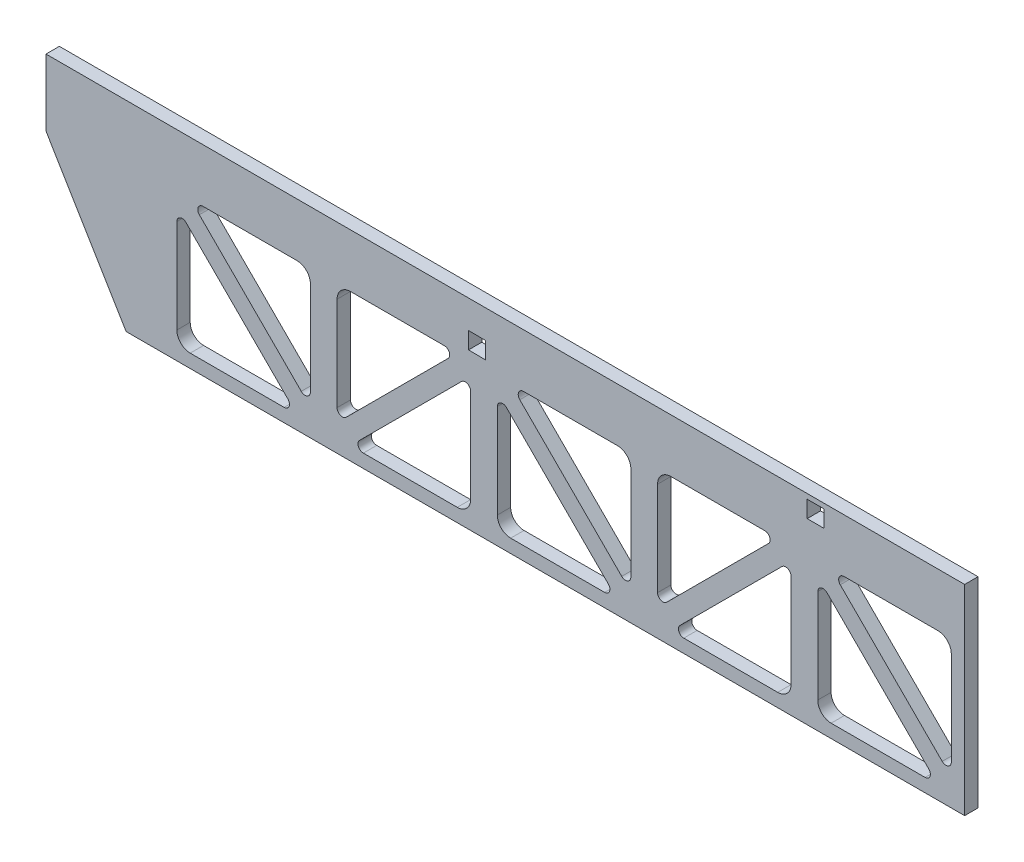
from build123d import *

# Parameters (mm, degrees)
MODEL_W             = 8.001
MODEL_H             = 8.001
BOSS_EXTRUDE1_DEPTH = 6.35


with BuildPart() as part:
    # Model → Boss-Extrude1 (new body)
    with BuildSketch(Plane.XY):
        Polygon((-398.78, 0), (-436.88, 63.5), (-436.88, 95.25), (0, 95.25), (0, 0), align=None)
        with Locations((-70.891200524, 88.9)):
            Rectangle(MODEL_W, MODEL_H, mode=Mode.SUBTRACT)
        Polygon((-235.938184475, 73.86541105), (-227.937630461, 73.78093355), (-227.853152962, 81.781487564), (-235.853706976, 81.865965064), align=None, mode=Mode.SUBTRACT)
        with BuildLine():
            Line((-171.232102448, 6.35), (-215.9, 6.35))
            ThreePointArc((-215.9, 6.35), (-220.390128061, 8.209871939), (-222.25, 12.7))
            Line((-222.25, 12.7), (-222.25, 57.367897552))
            ThreePointArc((-222.25, 57.367897552), (-220.682015918, 59.714551564), (-217.913948776, 59.163948776))
            Line((-217.913948776, 59.163948776), (-169.436051224, 10.686051224))
            ThreePointArc((-169.436051224, 10.686051224), (-168.885448436, 7.917984082), (-171.232102448, 6.35))
        make_face(mode=Mode.SUBTRACT)
        with BuildLine():
            Line((-234.95, 57.367897552), (-234.95, 12.7))
            ThreePointArc((-234.95, 12.7), (-236.809871939, 8.209871939), (-241.3, 6.35))
            Line((-241.3, 6.35), (-285.967897552, 6.35))
            ThreePointArc((-285.967897552, 6.35), (-288.314551564, 7.917984082), (-287.763948776, 10.686051224))
            Line((-287.763948776, 10.686051224), (-239.286051224, 59.163948776))
            ThreePointArc((-239.286051224, 59.163948776), (-236.517984082, 59.714551564), (-234.95, 57.367897552))
        make_face(mode=Mode.SUBTRACT)
        with BuildLine():
            Line((-294.113948776, 17.036051224), (-245.636051224, 65.513948776))
            ThreePointArc((-245.636051224, 65.513948776), (-245.085448436, 68.282015918), (-247.432102448, 69.85))
            Line((-247.432102448, 69.85), (-292.1, 69.85))
            ThreePointArc((-292.1, 69.85), (-296.590128061, 67.990128061), (-298.45, 63.5))
            Line((-298.45, 63.5), (-298.45, 18.832102448))
            ThreePointArc((-298.45, 18.832102448), (-296.882015918, 16.485448436), (-294.113948776, 17.036051224))
        make_face(mode=Mode.SUBTRACT)
        with BuildLine():
            Line((-323.632102448, 6.35), (-368.3, 6.35))
            ThreePointArc((-368.3, 6.35), (-372.790128061, 8.209871939), (-374.65, 12.7))
            Line((-374.65, 12.7), (-374.65, 57.367897552))
            ThreePointArc((-374.65, 57.367897552), (-373.082015918, 59.714551564), (-370.313948776, 59.163948776))
            Line((-370.313948776, 59.163948776), (-321.836051224, 10.686051224))
            ThreePointArc((-321.836051224, 10.686051224), (-321.285448436, 7.917984082), (-323.632102448, 6.35))
        make_face(mode=Mode.SUBTRACT)
        with BuildLine():
            Line((-18.832102448, 6.35), (-63.5, 6.35))
            ThreePointArc((-63.5, 6.35), (-67.990128061, 8.209871939), (-69.85, 12.7))
            Line((-69.85, 12.7), (-69.85, 57.367897552))
            ThreePointArc((-69.85, 57.367897552), (-68.282015918, 59.714551564), (-65.513948776, 59.163948776))
            Line((-65.513948776, 59.163948776), (-17.036051224, 10.686051224))
            ThreePointArc((-17.036051224, 10.686051224), (-16.485448436, 7.917984082), (-18.832102448, 6.35))
        make_face(mode=Mode.SUBTRACT)
        with BuildLine():
            Line((-82.55, 57.367897552), (-82.55, 12.7))
            ThreePointArc((-82.55, 12.7), (-84.409871939, 8.209871939), (-88.9, 6.35))
            Line((-88.9, 6.35), (-133.567897552, 6.35))
            ThreePointArc((-133.567897552, 6.35), (-135.914551564, 7.917984082), (-135.363948776, 10.686051224))
            Line((-135.363948776, 10.686051224), (-86.886051224, 59.163948776))
            ThreePointArc((-86.886051224, 59.163948776), (-84.117984082, 59.714551564), (-82.55, 57.367897552))
        make_face(mode=Mode.SUBTRACT)
        with BuildLine():
            Line((-93.236051224, 65.513948776), (-141.713948776, 17.036051224))
            ThreePointArc((-141.713948776, 17.036051224), (-144.482015918, 16.485448436), (-146.05, 18.832102448))
            Line((-146.05, 18.832102448), (-146.05, 63.5))
            ThreePointArc((-146.05, 63.5), (-144.190128061, 67.990128061), (-139.7, 69.85))
            Line((-139.7, 69.85), (-95.032102448, 69.85))
            ThreePointArc((-95.032102448, 69.85), (-92.685448436, 68.282015918), (-93.236051224, 65.513948776))
        make_face(mode=Mode.SUBTRACT)
        with BuildLine():
            Line((-163.086051224, 17.036051224), (-211.563948776, 65.513948776))
            ThreePointArc((-211.563948776, 65.513948776), (-212.114551564, 68.282015918), (-209.767897552, 69.85))
            Line((-209.767897552, 69.85), (-165.1, 69.85))
            ThreePointArc((-165.1, 69.85), (-160.609871939, 67.990128061), (-158.75, 63.5))
            Line((-158.75, 63.5), (-158.75, 18.832102448))
            ThreePointArc((-158.75, 18.832102448), (-160.317984082, 16.485448436), (-163.086051224, 17.036051224))
        make_face(mode=Mode.SUBTRACT)
        with BuildLine():
            Line((-315.486051224, 17.036051224), (-363.963948776, 65.513948776))
            ThreePointArc((-363.963948776, 65.513948776), (-364.514551564, 68.282015918), (-362.167897552, 69.85))
            Line((-362.167897552, 69.85), (-317.5, 69.85))
            ThreePointArc((-317.5, 69.85), (-313.009871939, 67.990128061), (-311.15, 63.5))
            Line((-311.15, 63.5), (-311.15, 18.832102448))
            ThreePointArc((-311.15, 18.832102448), (-312.717984082, 16.485448436), (-315.486051224, 17.036051224))
        make_face(mode=Mode.SUBTRACT)
        with BuildLine():
            Line((-6.35, 63.5), (-6.35, 18.832102448))
            ThreePointArc((-6.35, 18.832102448), (-7.917984082, 16.485448436), (-10.686051224, 17.036051224))
            Line((-10.686051224, 17.036051224), (-59.163948776, 65.513948776))
            ThreePointArc((-59.163948776, 65.513948776), (-59.714551564, 68.282015918), (-57.367897552, 69.85))
            Line((-57.367897552, 69.85), (-12.7, 69.85))
            ThreePointArc((-12.7, 69.85), (-8.209871939, 67.990128061), (-6.35, 63.5))
        make_face(mode=Mode.SUBTRACT)
    extrude(amount=BOSS_EXTRUDE1_DEPTH)


solid = part.part
